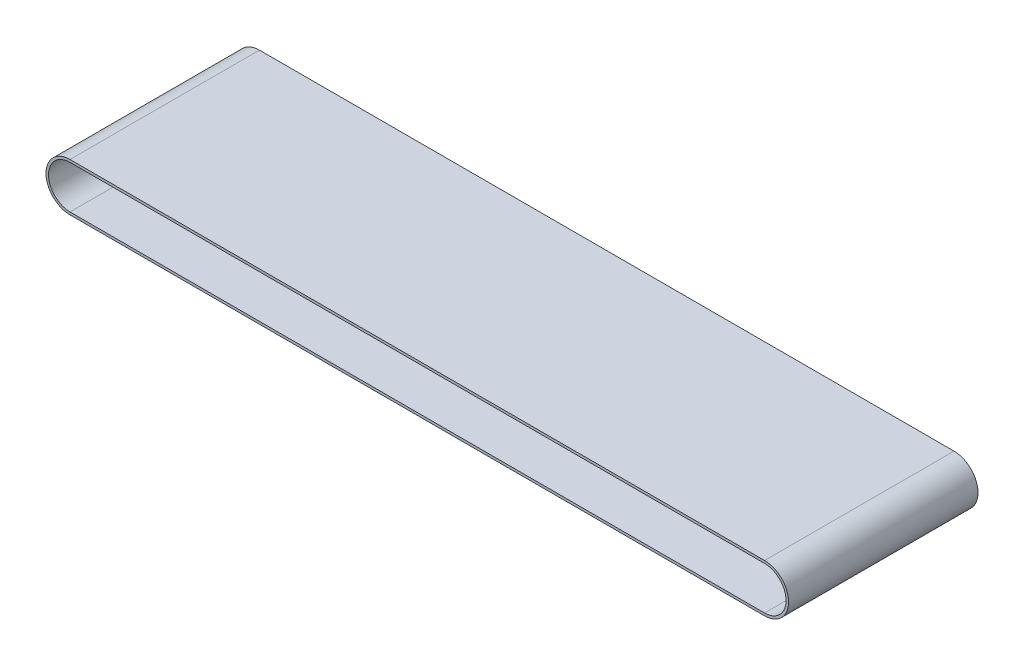
from build123d import *

# Parameters (mm, degrees)
BOSS_EXTRUDE1_DEPTH = 150
CUT_EXTRUDE1_DEPTH  = 150
BOSS_EXTRUDE2_DEPTH = 150
CUT_EXTRUDE2_DEPTH  = 168
BOSS_EXTRUDE4_DEPTH = 150
CUT_EXTRUDE3_DEPTH  = 225
CUT_EXTRUDE4_DEPTH  = 225


with BuildPart() as part:
    # Sketch1 → Boss-Extrude1 (new body)
    with BuildSketch(Plane.XY):
        with BuildLine():
            Line((0, 18), (550, 18))
            ThreePointArc((550, 18), (568, 0), (550, -18))
            Line((550, -18), (0, -18))
            ThreePointArc((0, -18), (-18, 0), (0, 18))
        make_face()
    extrude(amount=BOSS_EXTRUDE1_DEPTH)

    # Sketch2 → Cut-Extrude1 (cut)
    with BuildSketch(Plane.XY.offset(150)):
        with BuildLine():
            Line((0, -16), (550, -16))
            ThreePointArc((550, -16), (566, 0), (550, 16))
            Line((550, 16), (0, 16))
            ThreePointArc((0, 16), (-16, 0), (0, -16))
        make_face()
    extrude(amount=-CUT_EXTRUDE1_DEPTH, mode=Mode.SUBTRACT)

    # Sketch3 → Boss-Extrude2 (add)
    with BuildSketch(Plane.XY.offset(150)):
        with BuildLine():
            Line((0, -20), (550, -20))
            ThreePointArc((550, -20), (570, 0), (550, 20))
            Line((550, 20), (0, 20))
            ThreePointArc((0, 20), (-20, 0), (0, -20))
        make_face()
    extrude(amount=-BOSS_EXTRUDE2_DEPTH)

    # Sketch4 → Cut-Extrude2 (cut)
    with BuildSketch(Plane.XY.offset(150)):
        with BuildLine():
            Line((0, -18), (550, -18))
            ThreePointArc((550, -18), (568, 0), (550, 18))
            Line((550, 18), (0, 18))
            ThreePointArc((0, 18), (-18, 0), (0, -18))
        make_face()
    extrude(amount=-CUT_EXTRUDE2_DEPTH, mode=Mode.SUBTRACT)

    # Sketch5 → Boss-Extrude4 (add)
    with BuildSketch(Plane.XY.offset(150)):
        with BuildLine():
            Line((0, -18), (550, -18))
            ThreePointArc((550, -18), (568, 0), (550, 18))
            Line((550, 18), (0, 18))
            ThreePointArc((0, 18), (-18, 0), (0, -18))
        make_face()
    extrude(amount=-BOSS_EXTRUDE4_DEPTH)

    # Sketch7 → Cut-Extrude3 (cut)
    with BuildSketch(Plane.XY.offset(150)):
        with BuildLine():
            Line((0, -17), (550, -17))
            ThreePointArc((550, -17), (567, 0), (550, 17))
            Line((550, 17), (0, 17))
            ThreePointArc((0, 17), (-17, 0), (0, -17))
        make_face()
    extrude(amount=-CUT_EXTRUDE3_DEPTH, mode=Mode.SUBTRACT)

    # Sketch8 → Cut-Extrude4 (cut)
    with BuildSketch(Plane.XY.offset(150)):
        with BuildLine():
            Line((0, 20), (550, 20))
            ThreePointArc((550, 20), (570, 0), (550, -20))
            Line((550, -20), (0, -20))
            ThreePointArc((0, -20), (-20, 0), (0, 20))
        make_face()
        with BuildLine():
            Line((0, 19), (550, 19))
            ThreePointArc((550, 19), (569, 0), (550, -19))
            Line((550, -19), (0, -19))
            ThreePointArc((0, -19), (-19, 0), (0, 19))
        make_face(mode=Mode.SUBTRACT)
    extrude(amount=-CUT_EXTRUDE4_DEPTH, mode=Mode.SUBTRACT)


solid = part.part
